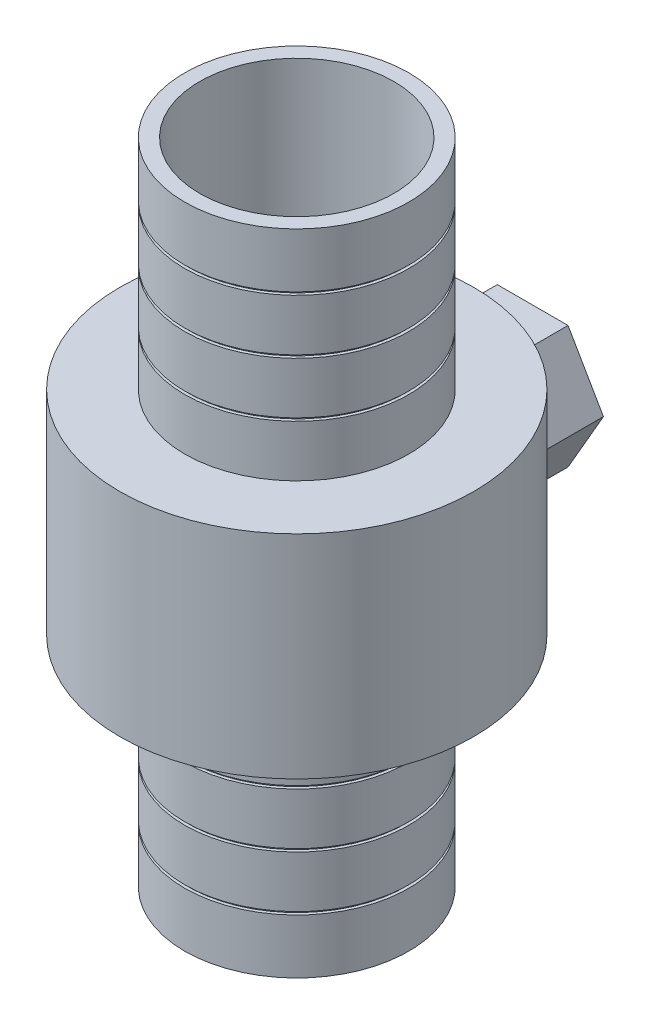
from build123d import *

# Parameters (mm, degrees)
SKETCH1_R                 = 9.5
BOSS_EXTRUDE1_DEPTH       = 18.5
SKETCH2_R                 = 15
BOSS_EXTRUDE2_DEPTH       = 18
SKETCH3_R                 = 9.5
BOSS_EXTRUDE3_DEPTH       = 18.5
SKETCH4_R                 = 9.5
SKETCH4_R_2               = 9.25
CUT_EXTRUDE3_DEPTH        = 0.25
LPATTERN1_COUNT           = 3
LPATTERN1_PITCH           = 4.625
MIRROR1_COPY_1_SKETCH_R   = 9.5
MIRROR1_COPY_1_SKETCH_R_2 = 9.25
MIRROR1_COPY_1_DEPTH      = 0.25
MIRROR1_COPY_2_SKETCH_R   = 9.5
MIRROR1_COPY_2_SKETCH_R_2 = 9.25
MIRROR1_COPY_2_DEPTH      = 0.25
BOSS_EXTRUDE4_DEPTH       = 5
SKETCH6_R                 = 8.23
CUT_EXTRUDE4_DEPTH        = 61.415229868


with BuildPart() as part:
    # Sketch1 → Boss-Extrude1 (new body)
    with BuildSketch(Plane(origin=(0, 0, 0), x_dir=(1, 0, 0), z_dir=(0, 1, 0))):
        with Locations(Location((0, 0, 0), (0, 0, 270))):
            Circle(SKETCH1_R)
    extrude(amount=BOSS_EXTRUDE1_DEPTH)

    # Sketch2 → Boss-Extrude2 (add)
    with BuildSketch(Plane(origin=(0, 18.5, 0), x_dir=(1, 0, 0), z_dir=(0, 1, 0))):
        with Locations(Location((0, 0, 0), (0, 0, 270))):
            Circle(SKETCH2_R)
    extrude(amount=BOSS_EXTRUDE2_DEPTH)

    # Sketch3 → Boss-Extrude3 (add)
    with BuildSketch(Plane(origin=(0, 36.5, 0), x_dir=(1, 0, 0), z_dir=(0, 1, 0))):
        with Locations(Location((0, 0, 0), (0, 0, 270))):
            Circle(SKETCH3_R)
    extrude(amount=BOSS_EXTRUDE3_DEPTH)

    # Sketch4 → Cut-Extrude3 (cut)
    with BuildSketch(Plane(origin=(0, 4.625, 0), x_dir=(-1, 0, 0), z_dir=(0, -1, 0))):
        with Locations(Location((0, 0, 0), (0, 0, 90))):
            Circle(SKETCH4_R)
        with Locations(Location((0, 0, 0), (0, 0, 90))):
            Circle(SKETCH4_R_2, mode=Mode.SUBTRACT)
    cut_extrude3 = extrude(amount=-CUT_EXTRUDE3_DEPTH, mode=Mode.SUBTRACT)

    # LPattern1: Cut-Extrude3 ×3
    with Locations(*[(0, i * LPATTERN1_PITCH, 0) for i in range(1, LPATTERN1_COUNT)]):
        add(cut_extrude3, mode=Mode.SUBTRACT)

    # Mirror1: Cut-Extrude3 across plane
    add(cut_extrude3.mirror(Plane(origin=(0, 27.5, 0), x_dir=(0, 0, 1), z_dir=(0, -1, 0))), mode=Mode.SUBTRACT)

    # Mirror1 copy 1 sketch → Mirror1 copy 1 (cut)
    with BuildSketch(Plane(origin=(0, 45.75, 0), x_dir=(-1, 0, 0), z_dir=(0, 1, 0))):
        Circle(MIRROR1_COPY_1_SKETCH_R)
        Circle(MIRROR1_COPY_1_SKETCH_R_2, mode=Mode.SUBTRACT)
    extrude(amount=-MIRROR1_COPY_1_DEPTH, mode=Mode.SUBTRACT)

    # Mirror1 copy 2 sketch → Mirror1 copy 2 (cut)
    with BuildSketch(Plane(origin=(0, 41.125, 0), x_dir=(-1, 0, 0), z_dir=(0, 1, 0))):
        Circle(MIRROR1_COPY_2_SKETCH_R)
        Circle(MIRROR1_COPY_2_SKETCH_R_2, mode=Mode.SUBTRACT)
    extrude(amount=-MIRROR1_COPY_2_DEPTH, mode=Mode.SUBTRACT)

    # Sketch6 → Cut-Extrude4 (cut, through all)
    with BuildSketch(Plane(origin=(0, 55, 0), x_dir=(1, 0, 0), z_dir=(0, 1, 0))):
        with Locations(Location((0, 0, 0), (0, 0, 270))):
            Circle(SKETCH6_R)
    extrude(amount=-CUT_EXTRUDE4_DEPTH, mode=Mode.SUBTRACT)


with BuildPart() as body_2:
    # Sketch5 → Boss-Extrude4 (new body)
    with BuildSketch(Plane(origin=(0, 0, -15), x_dir=(-1, 0, 0), z_dir=(0, 0, -1))):
        Polygon((-3, 22.303847577), (3, 22.303847577), (6, 27.5), (3, 32.696152423), (-3, 32.696152423), (-6, 27.5), align=None)
    extrude(amount=BOSS_EXTRUDE4_DEPTH)


solid = Compound([part.part, body_2.part])
